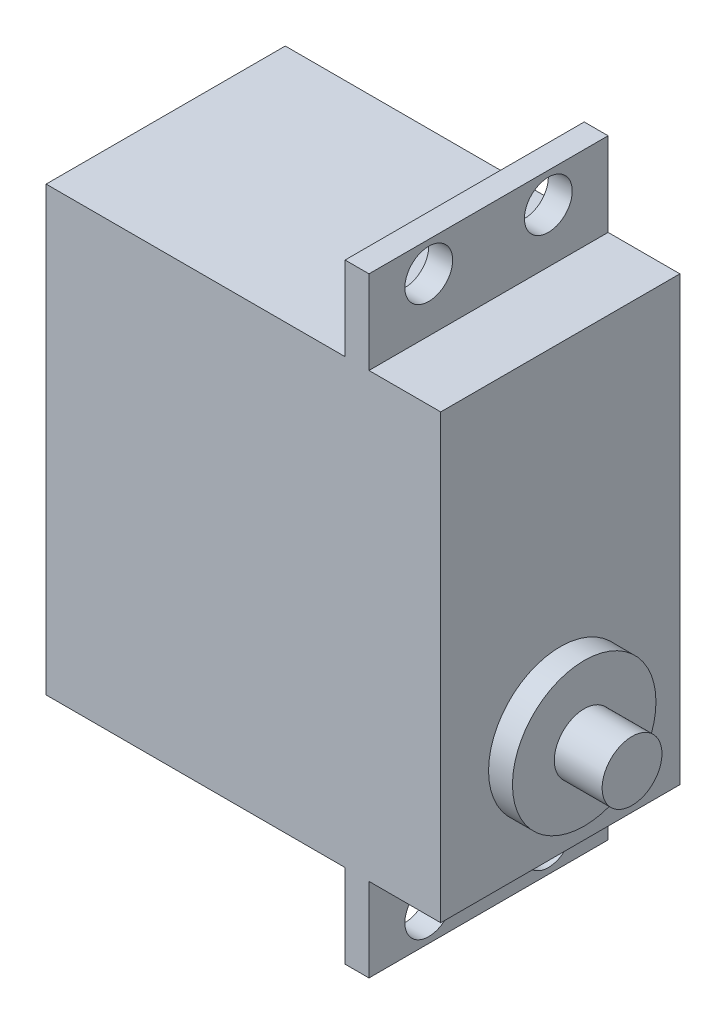
from build123d import *

# Parameters (mm, degrees)
ESQUISSE2_W                   = 33
ESQUISSE2_H                   = 20
BOSS_EXTRU_1_DEPTH            = 18.5
ESQUISSE3_W                   = 2
ESQUISSE3_H                   = 20
BOSS_EXTRU_2_DEPTH            = 7
ESQUISSE4_R                   = 6
BOSS_EXTRU_3_DEPTH            = 2
ESQUISSE5_R                   = 2.5
BOSS_EXTRU_4_DEPTH            = 4
DIAM_TRE_DU_PER_AGE_4_0_4_1_D = 4


with BuildPart() as part:
    # Esquisse2 → Boss.-Extru.1 (new body)
    with BuildSketch(Plane(origin=(0, 0, 0), x_dir=(1, 0, 0), z_dir=(0, 1, 0))):
        with Locations((16.5, 10)):
            Rectangle(ESQUISSE2_W, ESQUISSE2_H)
    boss_extru_1 = extrude(amount=BOSS_EXTRU_1_DEPTH)

    # Esquisse3 → Boss.-Extru.2 (add)
    with BuildSketch(Plane.XZ):
        with Locations((26, -10)):
            Rectangle(ESQUISSE3_W, ESQUISSE3_H)
    boss_extru_2 = extrude(amount=BOSS_EXTRU_2_DEPTH)

    # Symétrie1: Boss.-Extru.1, Boss.-Extru.2 across plane
    add(boss_extru_1.mirror(Plane(origin=(0, 18.5, 0), x_dir=(0, 0, 1), z_dir=(0, -1, 0))))
    add(boss_extru_2.mirror(Plane(origin=(0, 18.5, 0), x_dir=(0, 0, 1), z_dir=(0, -1, 0))))

    # Esquisse4 → Boss.-Extru.3 (add)
    with BuildSketch(Plane(origin=(33, 0, 0), x_dir=(0, 0, -1), z_dir=(1, 0, 0))):
        with Locations(Location((10, 9, 0), (0, 0, 180))):
            Circle(ESQUISSE4_R)
    extrude(amount=BOSS_EXTRU_3_DEPTH)

    # Esquisse5 → Boss.-Extru.4 (add)
    with BuildSketch(Plane(origin=(35, 0, 0), x_dir=(0, 0, -1), z_dir=(1, 0, 0))):
        with Locations((10, 9)):
            Circle(ESQUISSE5_R)
    extrude(amount=BOSS_EXTRU_4_DEPTH)

    # Diamètre du perçage Ø4.0 (4)1 (through all)
    with Locations(Plane(origin=(27, 0, 0), x_dir=(0, 0, -1), z_dir=(1, 0, 0))):
        with Locations((15, 41.5), (5, 41.5), (15, -4.5), (5, -4.5)):
            Hole(DIAM_TRE_DU_PER_AGE_4_0_4_1_D / 2)


solid = part.part
